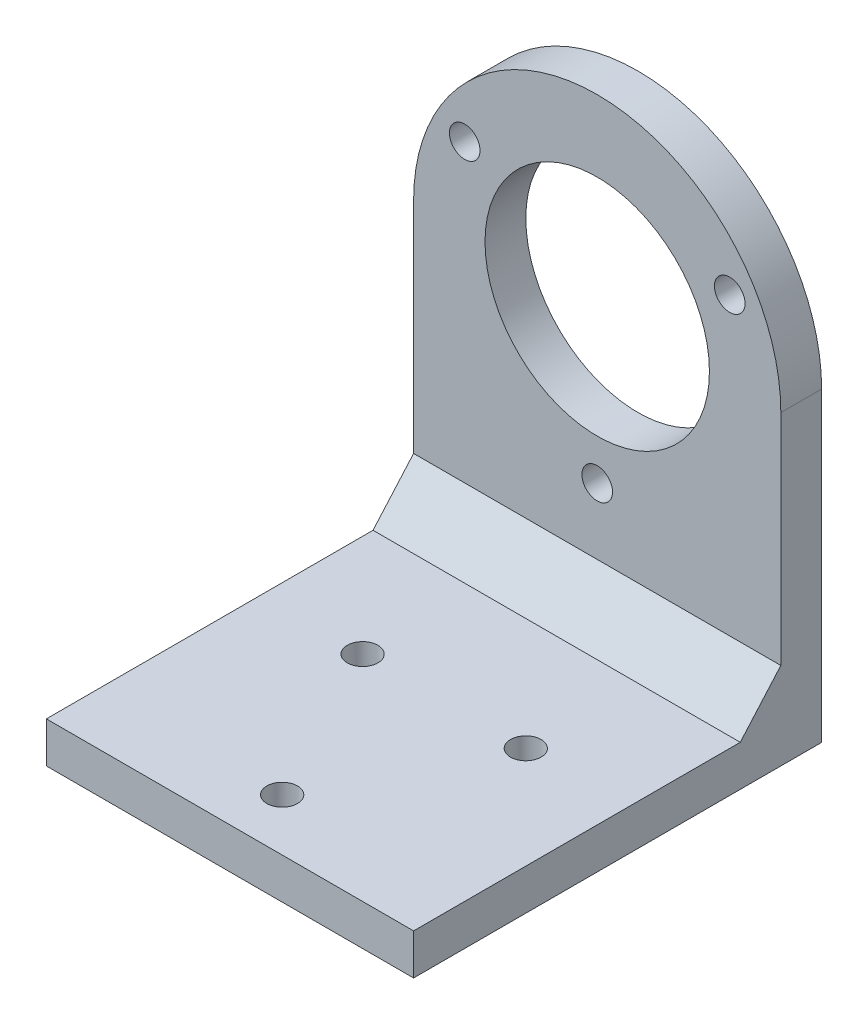
from build123d import *

# Parameters (mm, degrees)
BOSS_EXTRUDE1_DEPTH = 4
SKETCH3_W           = 36
SKETCH3_H           = 4
BOSS_EXTRUDE2_DEPTH = 40
SKETCH4_R           = 11
SKETCH4_R_2         = 1.5
CUT_EXTRUDE1_DEPTH  = 22
SKETCH5_R           = 1.5
CUT_EXTRUDE2_DEPTH  = 10
BOSS_EXTRUDE4_DEPTH = 36


with BuildPart() as part:
    # Sketch1 → Boss-Extrude1 (new body)
    with BuildSketch(Plane.XY):
        with BuildLine():
            Line((-38.900365485, 21.830923248), (-38.900365485, -8.169076752))
            Line((-38.900365485, -8.169076752), (-2.900365485, -8.169076752))
            Line((-2.900365485, -8.169076752), (-2.900365485, 21.830923248))
            ThreePointArc((-2.900365485, 21.830923248), (-20.900365485, 39.830923248), (-38.900365485, 21.830923248))
        make_face()
    extrude(amount=BOSS_EXTRUDE1_DEPTH)

    # Sketch3 → Boss-Extrude2 (add)
    with BuildSketch(Plane.XY):
        with Locations((-20.900365485, -6.169076752)):
            Rectangle(SKETCH3_W, SKETCH3_H)
    extrude(amount=BOSS_EXTRUDE2_DEPTH)

    # Sketch4 → Cut-Extrude1 (cut)
    with BuildSketch(Plane.XY):
        with Locations(Location((-20.900365485, 21.830923248, 0), (0, 0, 180))):
            Circle(SKETCH4_R)
        with Locations(Location((-20.900365485, 6.830923248, 0), (0, 0, 180))):
            Circle(SKETCH4_R_2)
        with Locations(Location((-33.890746542, 29.330923248, 0), (0, 0, 180))):
            Circle(SKETCH4_R_2)
        with Locations(Location((-7.909984429, 29.330923248, 0), (0, 0, 180))):
            Circle(SKETCH4_R_2)
    extrude(amount=CUT_EXTRUDE1_DEPTH, mode=Mode.SUBTRACT)

    # Sketch5 → Cut-Extrude2 (cut)
    with BuildSketch(Plane(origin=(0, 0, 0), x_dir=(1, 0, 0), z_dir=(0, 1, 0))):
        with Locations(Location((-28.900365485, -19, 0), (0, 0, 270))):
            Circle(SKETCH5_R)
        with Locations(Location((-12.900365485, -19, 0), (0, 0, 270))):
            Circle(SKETCH5_R)
        with Locations(Location((-20.900365485, -34.884, 0), (0, 0, 270))):
            Circle(SKETCH5_R)
    extrude(amount=-CUT_EXTRUDE2_DEPTH, mode=Mode.SUBTRACT)

    # Sketch7 → Boss-Extrude4 (add)
    with BuildSketch(Plane(origin=(-2.900365485, 0, 0), x_dir=(0, 0, -1), z_dir=(1, 0, 0))):
        Polygon((-4, 0.364546523), (-7.977975303, -4.169076752), (-4, -4.169076752), align=None)
    extrude(amount=-BOSS_EXTRUDE4_DEPTH)


solid = part.part
